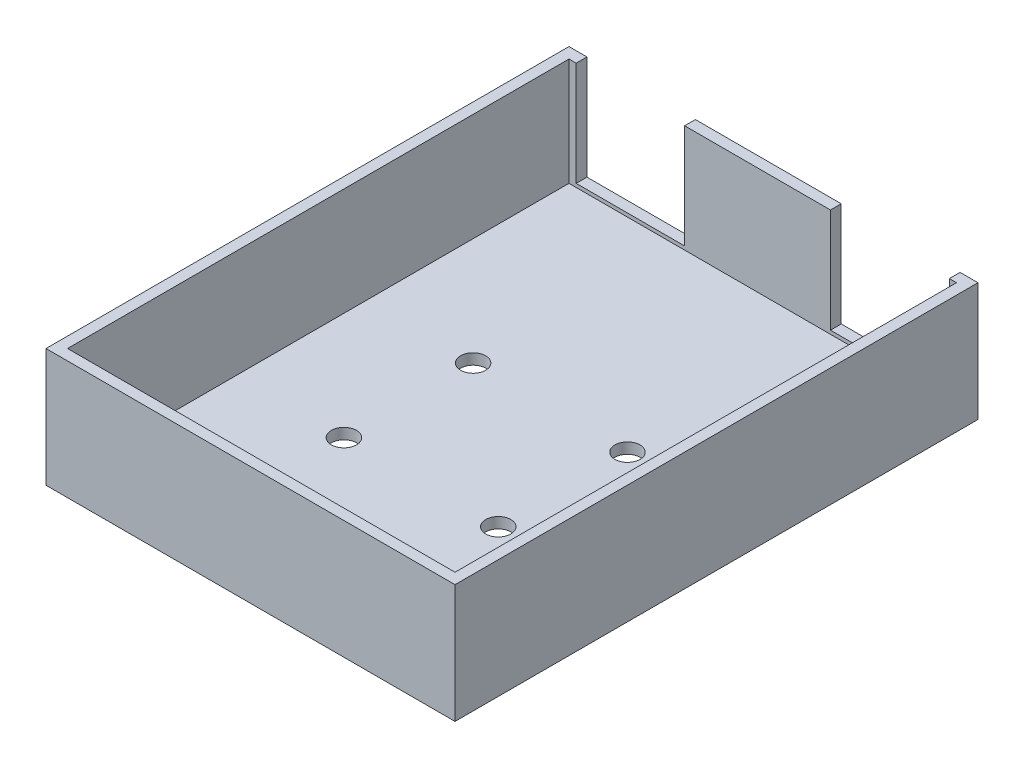
from build123d import *

# Parameters (mm, degrees)
SKETCH1_W           = 53.975
SKETCH1_H           = 69.85
BOSS_EXTRUDE1_DEPTH = 1.5
SKETCH1_4_W         = 56.975
SKETCH1_4_H         = 72.85
SKETCH1_4_W_2       = 53.975
SKETCH1_4_H_2       = 69.85
BOSS_EXTRUDE2_DEPTH = 16.5
CUT_EXTRUDE1_REACH  = 84.822
SKETCH2_W           = 16.55
SKETCH2_H           = 14.5
SKETCH2_W_2         = 15.105
CUT_EXTRUDE2_REACH  = 64.928
SKETCH3_R           = 1.75


with BuildPart() as part:
    # Sketch1 → Boss-Extrude1 (new body)
    with BuildSketch(Plane(origin=(0, 0, 0), x_dir=(1, 0, 0), z_dir=(0, 1, 0))):
        with Locations((7.2918379, -12.641495434)):
            Rectangle(SKETCH1_W, SKETCH1_H)
    extrude(amount=BOSS_EXTRUDE1_DEPTH)

    # Sketch1<4> → Boss-Extrude2 (add)
    with BuildSketch(Plane(origin=(0, 0, 0), x_dir=(1, 0, 0), z_dir=(0, 1, 0))):
        with Locations((7.2918379, -12.641495434)):
            Rectangle(SKETCH1_4_W, SKETCH1_4_H)
        with Locations((7.2918379, -12.641495434)):
            Rectangle(SKETCH1_4_W_2, SKETCH1_4_H_2, mode=Mode.SUBTRACT)
    extrude(amount=BOSS_EXTRUDE2_DEPTH)

    # Sketch2 → Cut-Extrude1 (cut, up to next)
    with BuildSketch(Plane(origin=(0, 0, -23.783504566), x_dir=(-1, 0, 0), z_dir=(0, 0, -1)), mode=Mode.PRIVATE) as cut_extrude1_sk1:
        with Locations((-25.0043379, 9.25)):
            Rectangle(SKETCH2_W, SKETCH2_H)
    cut_extrude1_tool1 = extrude(cut_extrude1_sk1.sketch, amount=-CUT_EXTRUDE1_REACH, mode=Mode.PRIVATE) & part.part
    # Sketch2 → Cut-Extrude1 (cut, up to next)
    with BuildSketch(Plane(origin=(0, 0, -23.783504566), x_dir=(-1, 0, 0), z_dir=(0, 0, -1)), mode=Mode.PRIVATE) as cut_extrude1_sk2:
        with Locations((11.1431621, 9.25)):
            Rectangle(SKETCH2_W_2, SKETCH2_H)
    cut_extrude1_tool2 = extrude(cut_extrude1_sk2.sketch, amount=-CUT_EXTRUDE1_REACH, mode=Mode.PRIVATE) & part.part
    add(cut_extrude1_tool1.solids().sort_by_distance((25.004338, 9.25, -23.783505))[0], mode=Mode.SUBTRACT)
    add(cut_extrude1_tool2.solids().sort_by_distance((-11.143162, 9.25, -23.783505))[0], mode=Mode.SUBTRACT)

    # Sketch3 → Cut-Extrude2 (cut, up to next)
    with BuildSketch(Plane.XZ, mode=Mode.PRIVATE) as cut_extrude2_sk1:
        with Locations((16.8043379, 24.066495434)):
            Circle(SKETCH3_R)
    cut_extrude2_tool1 = extrude(cut_extrude2_sk1.sketch, amount=-CUT_EXTRUDE2_REACH, mode=Mode.PRIVATE) & part.part
    # Sketch3 → Cut-Extrude2 (cut, up to next)
    with BuildSketch(Plane.XZ, mode=Mode.PRIVATE) as cut_extrude2_sk2:
        with Locations((-4.6956621, 24.066495434)):
            Circle(SKETCH3_R)
    cut_extrude2_tool2 = extrude(cut_extrude2_sk2.sketch, amount=-CUT_EXTRUDE2_REACH, mode=Mode.PRIVATE) & part.part
    # Sketch3 → Cut-Extrude2 (cut, up to next)
    with BuildSketch(Plane.XZ, mode=Mode.PRIVATE) as cut_extrude2_sk3:
        with Locations((16.8043379, 6.066495434)):
            Circle(SKETCH3_R)
    cut_extrude2_tool3 = extrude(cut_extrude2_sk3.sketch, amount=-CUT_EXTRUDE2_REACH, mode=Mode.PRIVATE) & part.part
    # Sketch3 → Cut-Extrude2 (cut, up to next)
    with BuildSketch(Plane.XZ, mode=Mode.PRIVATE) as cut_extrude2_sk4:
        with Locations((-4.6956621, 6.066495434)):
            Circle(SKETCH3_R)
    cut_extrude2_tool4 = extrude(cut_extrude2_sk4.sketch, amount=-CUT_EXTRUDE2_REACH, mode=Mode.PRIVATE) & part.part
    add(cut_extrude2_tool1.solids().sort_by_distance((16.804338, 0, 24.066495))[0], mode=Mode.SUBTRACT)
    add(cut_extrude2_tool2.solids().sort_by_distance((-4.695662, 0, 24.066495))[0], mode=Mode.SUBTRACT)
    add(cut_extrude2_tool3.solids().sort_by_distance((16.804338, 0, 6.066495))[0], mode=Mode.SUBTRACT)
    add(cut_extrude2_tool4.solids().sort_by_distance((-4.695662, 0, 6.066495))[0], mode=Mode.SUBTRACT)


solid = part.part
